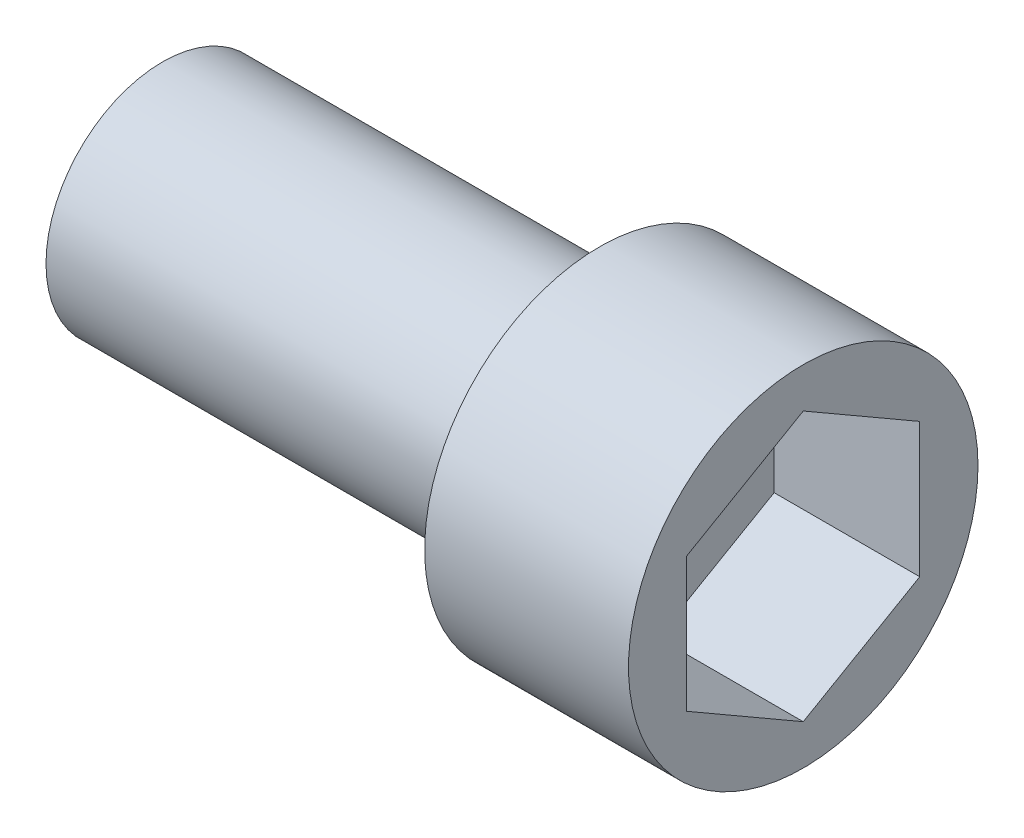
from build123d import *

# Parameters (mm, degrees)
SKETCH1_R           = 6
BOSS_EXTRUDE1_DEPTH = 7
CUT_EXTRUDE1_DEPTH  = 5
SKETCH3_R           = 4
BOSS_EXTRUDE2_DEPTH = 15


with BuildPart() as part:
    # Sketch1 → Boss-Extrude1 (new body)
    with BuildSketch(Plane.YZ):
        with Locations(Location((0, 0, 0), (0, 0, 270))):
            Circle(SKETCH1_R)
    extrude(amount=BOSS_EXTRUDE1_DEPTH)

    # Sketch2 → Cut-Extrude1 (cut)
    with BuildSketch(Plane.YZ.offset(7)):
        Polygon((4.618802154, 0), (2.309401077, 4), (-2.309401077, 4), (-4.618802154, 0), (-2.309401077, -4), (2.309401077, -4), align=None)
    extrude(amount=-CUT_EXTRUDE1_DEPTH, mode=Mode.SUBTRACT)

    # Sketch3 → Boss-Extrude2 (add)
    with BuildSketch(Plane(origin=(0, 0, 0), x_dir=(0, -1, 0), z_dir=(-1, 0, 0))):
        with Locations(Location((0, 0, 0), (0, 0, 90))):
            Circle(SKETCH3_R)
    extrude(amount=BOSS_EXTRUDE2_DEPTH)


solid = part.part
